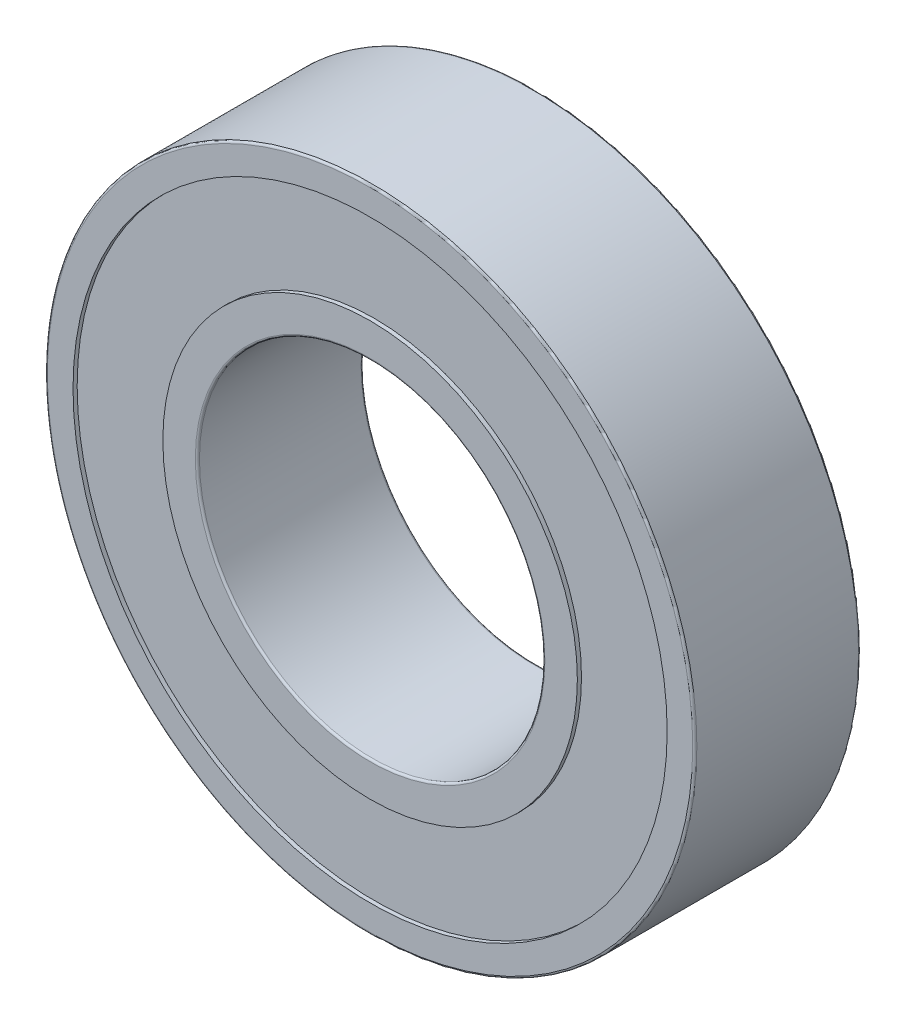
from build123d import *

# Parameters (mm, degrees)
SKETCH1_R           = 23.5
SKETCH1_R_2         = 12.5
BOSS_EXTRUDE1_DEPTH = 12
SKETCH2_R           = 21.5
SKETCH2_R_2         = 15
CUT_EXTRUDE1_DEPTH  = 0.3
CUT_EXTRUDE2_START  = -11.5
SKETCH2_2_R         = 21.5
SKETCH2_2_R_2       = 15
CUT_EXTRUDE2_DEPTH  = 0.5
FILLET1_R           = 0.15


with BuildPart() as part:
    # Sketch1 → Boss-Extrude1 (new body)
    with BuildSketch(Plane.XY):
        Circle(SKETCH1_R)
        Circle(SKETCH1_R_2, mode=Mode.SUBTRACT)
    extrude(amount=BOSS_EXTRUDE1_DEPTH)

    # Sketch2 → Cut-Extrude1 (cut)
    with BuildSketch(Plane.XY.offset(12)):
        Circle(SKETCH2_R)
        Circle(SKETCH2_R_2, mode=Mode.SUBTRACT)
    extrude(amount=-CUT_EXTRUDE1_DEPTH, mode=Mode.SUBTRACT)

    # Sketch2<2> → Cut-Extrude2 (cut)
    with BuildSketch(Plane.XY.offset(12).offset(CUT_EXTRUDE2_START)):
        Circle(SKETCH2_2_R)
        Circle(SKETCH2_2_R_2, mode=Mode.SUBTRACT)
    extrude(amount=-CUT_EXTRUDE2_DEPTH, mode=Mode.SUBTRACT)

    # Fillet1
    fillet1_edges = [part.edges().sort_by_distance(p)[0] for p in [
        (-23.5, 0, 0),
        (-23.5, 0, 12),
        (-12.5, 0, 0),
        (-12.5, 0, 12),
    ]]
    fillet(fillet1_edges, radius=FILLET1_R)


solid = part.part
